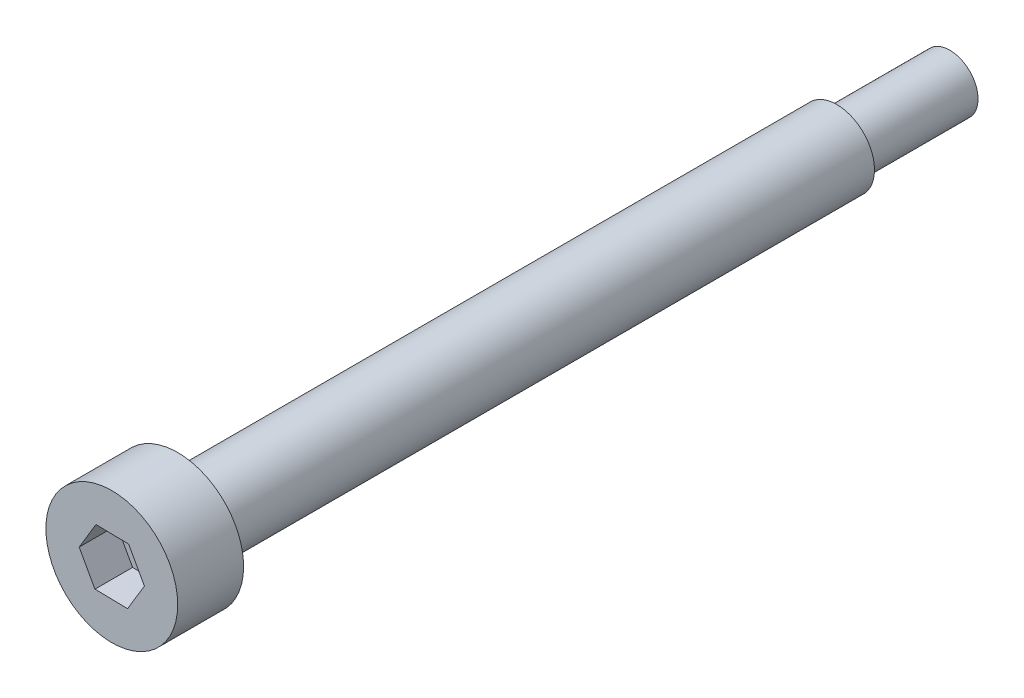
from build123d import *

# Parameters (mm, degrees)
SKETCH_1_R          = 3.5
EXTRUDE_1_DEPTH     = 3.5
CUT_EXTRUDE_1_DEPTH = 2
SKETCH_3_R          = 2
EXTRUDE_2_DEPTH     = 35
SKETCH_4_R          = 1.5
EXTRUDE_3_DEPTH     = 6


with BuildPart() as part:
    # 草图1 → 凸台-拉伸1 (new body)
    with BuildSketch(Plane.XY):
        Circle(SKETCH_1_R)
    extrude(amount=EXTRUDE_1_DEPTH)

    # 草图2 → 切除-拉伸1 (cut)
    with BuildSketch(Plane.XY.offset(3.5)):
        Polygon((0.893639487, 1.483714416), (-0.838114632, 1.515771705), (-1.731754119, 0.03205729), (-0.893639487, -1.483714416), (0.838114632, -1.515771705), (1.731754119, -0.03205729), align=None)
    extrude(amount=-CUT_EXTRUDE_1_DEPTH, mode=Mode.SUBTRACT)

    # 草图3 → 凸台-拉伸2 (add)
    with BuildSketch(Plane(origin=(0, 0, 0), x_dir=(-1, 0, 0), z_dir=(0, 0, -1))):
        with Locations(Location((0, 0, 0), (0, 0, 180))):
            Circle(SKETCH_3_R)
    extrude(amount=EXTRUDE_2_DEPTH)

    # 草图4 → 凸台-拉伸3 (add)
    with BuildSketch(Plane(origin=(0, 0, -35), x_dir=(-1, 0, 0), z_dir=(0, 0, -1))):
        Circle(SKETCH_4_R)
    extrude(amount=EXTRUDE_3_DEPTH)


solid = part.part
